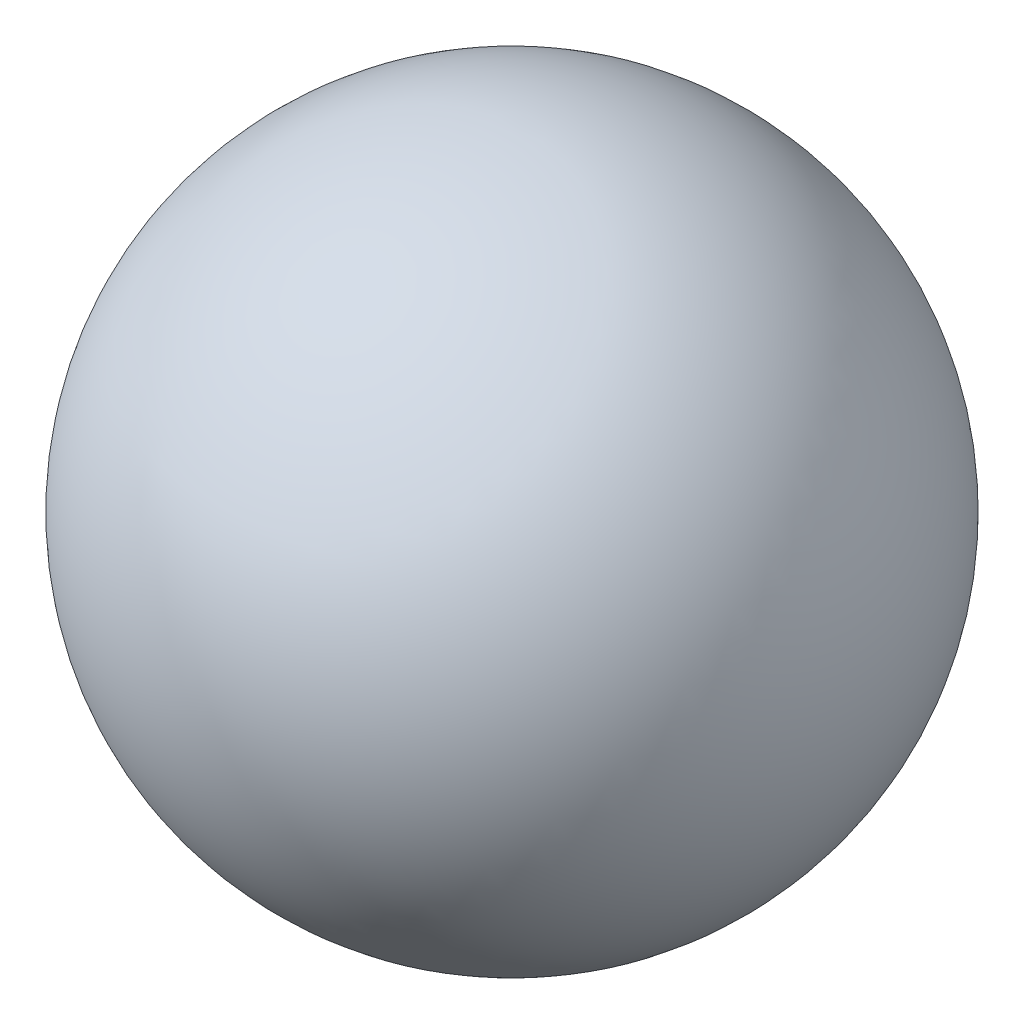
from build123d import *


with BuildPart() as part:
    # Skica1 → Rotovat1 (revolve)
    with BuildSketch(Plane.XY):
        with BuildLine():
            Line((0, 6.325), (0, -6.325))
            ThreePointArc((0, -6.325), (-6.325, 0), (0, 6.325))
        make_face()
    revolve(axis=Axis((0, -7.71637981, 0), (0, 1, 0)))


solid = part.part
